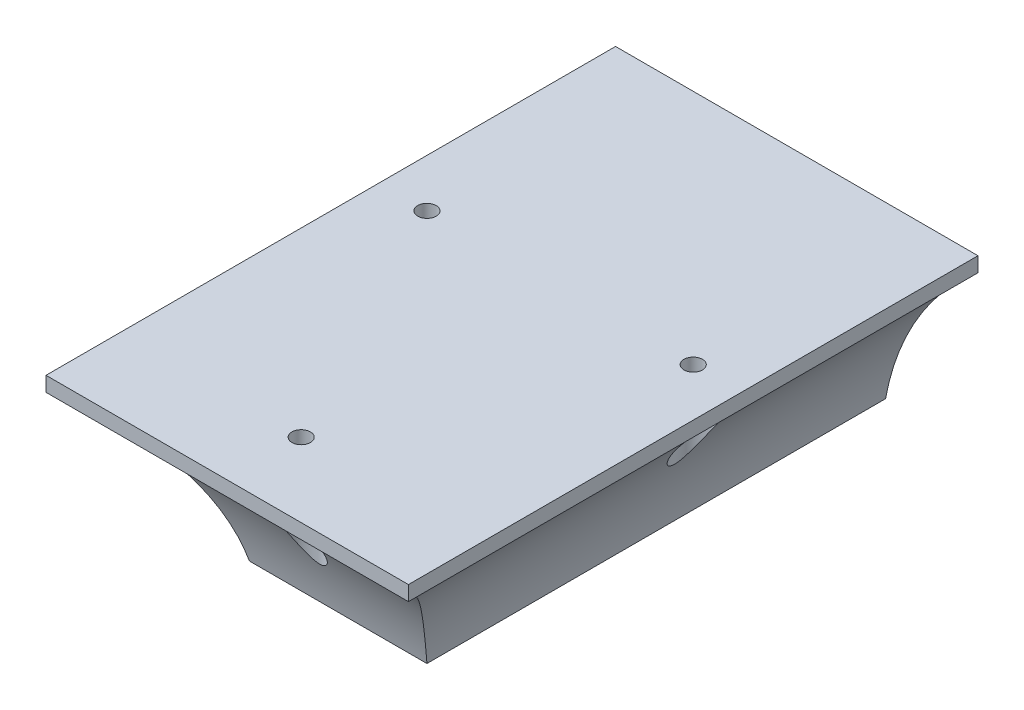
from build123d import *

# Parameters (mm, degrees)
BOSS_EXTRUDE1_DEPTH                  = 38.1
BOSS_EXTRUDE3_DEPTH                  = 76.2
BOSS_EXTRUDE2_REACH                  = 53.498
BOSS_EXTRUDE2_END_RADIUS             = 44.45
BOSS_EXTRUDE2_DIRECTION_2_REACH      = 53.498
BOSS_EXTRUDE2_DIRECTION_2_END_RADIUS = 44.45
CUT_EXTRUDE3_DEPTH                   = 86.067352916
CUT_EXTRUDE1_REACH                   = 71.308
SKETCH4_R                            = 3.175
CUT_EXTRUDE1_DIRECTION_2_DEPTH       = 6.35
CUT_EXTRUDE2_REACH                   = 73.089
SKETCH5_R                            = 1.5875
LPATTERN1_COUNT                      = 2
LPATTERN1_PITCH                      = 44.45
LPATTERN1_COUNT_DIR2                 = 2
LPATTERN1_PITCH_DIR2                 = 22.86
MIRROR1_COPY_1_REACH                 = 71.308
MIRROR1_COPY_1_SKETCH_R              = 3.175
MIRROR1_COPY_2_SKETCH_R              = 3.175
MIRROR1_COPY_2_DEPTH                 = 6.35
MIRROR1_COPY_3_REACH                 = 73.089
MIRROR1_COPY_3_SKETCH_R              = 1.5875


with BuildPart() as part:
    # Sketch1 → Boss-Extrude1 (new, symmetric)
    with BuildSketch(Plane.XY):
        with BuildLine():
            Line((12.7, 12.7), (-12.7, 12.7))
            Line((-12.7, 12.7), (-12.7, 3.175))
            Line((-12.7, 3.175), (-10.414, 3.175))
            Line((-10.414, 3.175), (-10.414, 5.148491853))
            ThreePointArc((-10.414, 5.148491853), (-10.075709883, 5.709908138), (-9.421281116, 5.673146216))
            Line((-9.421281116, 5.673146216), (-4.826, 2.54))
            Line((-4.826, 2.54), (-4.826, -2.54))
            Line((-4.826, -2.54), (-9.421281116, -5.673146216))
            ThreePointArc((-9.421281116, -5.673146216), (-10.075709883, -5.709908138), (-10.414, -5.148491853))
            Line((-10.414, -5.148491853), (-10.414, -3.175))
            Line((-10.414, -3.175), (-12.7, -3.175))
            Line((-12.7, -3.175), (-12.7, -12.7))
            Line((-12.7, -12.7), (-8.89, -12.7))
            Line((-8.89, -12.7), (-8.89, -13.97))
            Line((-8.89, -13.97), (-15.24, -13.97))
            Line((-15.24, -13.97), (-15.24, 15.24))
            Line((-15.24, 15.24), (15.24, 15.24))
            Line((15.24, 15.24), (15.24, -13.97))
            Line((15.24, -13.97), (8.89, -13.97))
            Line((8.89, -13.97), (8.89, -12.7))
            Line((8.89, -12.7), (12.7, -12.7))
            Line((12.7, -12.7), (12.7, -3.175))
            Line((12.7, -3.175), (10.414, -3.175))
            Line((10.414, -3.175), (10.414, -5.148491853))
            ThreePointArc((10.414, -5.148491853), (10.075709883, -5.709908138), (9.421281116, -5.673146216))
            Line((9.421281116, -5.673146216), (4.826, -2.54))
            Line((4.826, -2.54), (4.826, 2.54))
            Line((4.826, 2.54), (9.421281116, 5.673146216))
            ThreePointArc((9.421281116, 5.673146216), (10.075709883, 5.709908138), (10.414, 5.148491853))
            Line((10.414, 5.148491853), (10.414, 3.175))
            Line((10.414, 3.175), (12.7, 3.175))
            Line((12.7, 3.175), (12.7, 12.7))
        make_face()
    extrude(amount=BOSS_EXTRUDE1_DEPTH, both=True)

    # Sketch6 → Boss-Extrude3 (add)
    with BuildSketch(Plane(origin=(0, 0, -38.1), x_dir=(-1, 0, 0), z_dir=(0, 0, -1))):
        with BuildLine():
            Line((-15.24, 15.24), (-31.115, 15.24))
            Line((-31.115, 15.24), (-31.115, 12.7))
            ThreePointArc((-31.115, 12.7), (-20.774098647, 0.795596044), (-15.24, -13.97))
            Line((-15.24, -13.97), (-15.24, 15.24))
        make_face()
        with BuildLine():
            Line((15.24, 15.24), (31.115, 15.24))
            Line((31.115, 15.24), (31.115, 12.7))
            ThreePointArc((31.115, 12.7), (20.774098647, 0.795596044), (15.24, -13.97))
            Line((15.24, -13.97), (15.24, 15.24))
        make_face()
    extrude(amount=-BOSS_EXTRUDE3_DEPTH)

    # Boss-Extrude2: up to this cylinder (the profile starts outside it)
    boss_extrude2_end = Plane(origin=(58.969667359, -21.939861523, 45.16983), z_dir=(0, 0, -1)) * Cylinder(BOSS_EXTRUDE2_END_RADIUS, 196.896, mode=Mode.PRIVATE)
    # Sketch3 → Boss-Extrude2 (add, up to the surface)
    with BuildSketch(Plane(origin=(0, 0, 0), x_dir=(0, 0, -1), z_dir=(1, 0, 0)), mode=Mode.PRIVATE) as boss_extrude2_sk1:
        with BuildLine():
            Line((-59.69, 15.24), (-59.69, 12.7))
            ThreePointArc((-59.69, 12.7), (-47.617150174, 1.184892733), (-40.64, -13.97))
            Line((-40.64, -13.97), (-38.1, -13.97))
            Line((-38.1, -13.97), (-38.1, 15.24))
            Line((-38.1, 15.24), (-59.69, 15.24))
        make_face()
    boss_extrude2_tool1 = extrude(boss_extrude2_sk1.sketch, amount=BOSS_EXTRUDE2_REACH, mode=Mode.PRIVATE) - boss_extrude2_end
    add(boss_extrude2_tool1.solids().sort_by_distance((0, 5.474065, 45.16983))[0])

    # Boss-Extrude2 direction 2: up to this cylinder (the profile starts outside it)
    boss_extrude2_direction_2_end = Plane(origin=(-58.969667359, -21.939861523, 45.16983), z_dir=(0, 0, -1)) * Cylinder(BOSS_EXTRUDE2_DIRECTION_2_END_RADIUS, 196.896, mode=Mode.PRIVATE)
    # Sketch3 → Boss-Extrude2 direction 2 (add, up to the surface)
    with BuildSketch(Plane(origin=(0, 0, 0), x_dir=(0, 0, -1), z_dir=(1, 0, 0)), mode=Mode.PRIVATE) as boss_extrude2_direction_2_sk1:
        with BuildLine():
            Line((-59.69, 15.24), (-59.69, 12.7))
            ThreePointArc((-59.69, 12.7), (-47.617150174, 1.184892733), (-40.64, -13.97))
            Line((-40.64, -13.97), (-38.1, -13.97))
            Line((-38.1, -13.97), (-38.1, 15.24))
            Line((-38.1, 15.24), (-59.69, 15.24))
        make_face()
    boss_extrude2_direction_2_tool1 = extrude(boss_extrude2_direction_2_sk1.sketch, amount=-BOSS_EXTRUDE2_DIRECTION_2_REACH, mode=Mode.PRIVATE) - boss_extrude2_direction_2_end
    add(boss_extrude2_direction_2_tool1.solids().sort_by_distance((0, 5.474065, 45.16983))[0])

    # Sketch7 → Cut-Extrude3 (cut, through all)
    with BuildSketch(Plane(origin=(0, 0, 38.1), x_dir=(-1, 0, 0), z_dir=(0, 0, -1))):
        with BuildLine():
            Line((34.608624747, 15.24), (31.115, 15.24))
            Line((31.115, 15.24), (31.115, 12.7))
            ThreePointArc((31.115, 12.7), (32.830941454, 14.012461185), (34.608624747, 15.24))
        make_face()
        with BuildLine():
            Line((-31.115, 12.7), (-31.115, 15.24))
            Line((-31.115, 15.24), (-34.608624747, 15.24))
            ThreePointArc((-34.608624747, 15.24), (-32.830941454, 14.012461185), (-31.115, 12.7))
        make_face()
    extrude(amount=-CUT_EXTRUDE3_DEPTH, mode=Mode.SUBTRACT)

    # Sketch4 → Cut-Extrude1 (cut, up to next)
    with BuildSketch(Plane(origin=(0, 2.54, 0), x_dir=(1, 0, 0), z_dir=(0, 1, 0)), mode=Mode.PRIVATE) as cut_extrude1_sk1:
        with Locations(Location((0, -46.99, 0), (0, 0, 90))):
            Circle(SKETCH4_R)
    cut_extrude1_tool1 = extrude(cut_extrude1_sk1.sketch, amount=-CUT_EXTRUDE1_REACH, mode=Mode.PRIVATE) & part.part
    cut_extrude1 = cut_extrude1_tool1.solids().sort_by_distance((0, 2.54, 46.99))[0]
    add(cut_extrude1, mode=Mode.SUBTRACT)

    # Sketch4 → Cut-Extrude1 direction 2 (cut)
    with BuildSketch(Plane(origin=(0, 2.54, 0), x_dir=(1, 0, 0), z_dir=(0, 1, 0))):
        with Locations(Location((0, -46.99, 0), (0, 0, 90))):
            Circle(SKETCH4_R)
    cut_extrude1_direction_2 = extrude(amount=CUT_EXTRUDE1_DIRECTION_2_DEPTH, mode=Mode.SUBTRACT)

    # Sketch5 → Cut-Extrude2 (cut, up to next)
    with BuildSketch(Plane.XZ.offset(-8.89), mode=Mode.PRIVATE) as cut_extrude2_sk1:
        with Locations(Location((0, 46.99, 0), (0, 0, 270))):
            Circle(SKETCH5_R)
    cut_extrude2_tool1 = extrude(cut_extrude2_sk1.sketch, amount=-CUT_EXTRUDE2_REACH, mode=Mode.PRIVATE) & part.part
    cut_extrude2 = cut_extrude2_tool1.solids().sort_by_distance((0, 8.89, 46.99))[0]
    add(cut_extrude2, mode=Mode.SUBTRACT)

    # LPattern1: Cut-Extrude1, Cut-Extrude1 direction 2, Cut-Extrude2; each copy of Cut-Extrude1, Cut-Extrude2 runs up to whatever stops it at its own place
    lpattern1_before = part.part  # the part as the pattern finds it: every copy runs up to it
    lpattern1_cut_extrude1_long = extrude(cut_extrude1_sk1.sketch, amount=-CUT_EXTRUDE1_REACH, mode=Mode.PRIVATE)
    lpattern1_cut_extrude1_tool1 = lpattern1_cut_extrude1_long.moved(Location(Vector(0, 0, -1) * (1 * LPATTERN1_PITCH) + Vector(1, 0, 0) * (1 * LPATTERN1_PITCH_DIR2))) & lpattern1_before
    add(lpattern1_cut_extrude1_tool1.solids().sort_by_distance((22.86, 2.54, 2.54))[0], mode=Mode.SUBTRACT)
    add(cut_extrude1_direction_2.moved(Location(Vector(0, 0, -1) * (1 * LPATTERN1_PITCH) + Vector(1, 0, 0) * (1 * LPATTERN1_PITCH_DIR2))), mode=Mode.SUBTRACT)
    lpattern1_cut_extrude2_long = extrude(cut_extrude2_sk1.sketch, amount=-CUT_EXTRUDE2_REACH, mode=Mode.PRIVATE)
    lpattern1_cut_extrude2_tool1 = lpattern1_cut_extrude2_long.moved(Location(Vector(0, 0, -1) * (1 * LPATTERN1_PITCH) + Vector(1, 0, 0) * (1 * LPATTERN1_PITCH_DIR2))) & lpattern1_before
    add(lpattern1_cut_extrude2_tool1.solids().sort_by_distance((22.86, 8.89, 2.54))[0], mode=Mode.SUBTRACT)

    # Mirror1 copy 1 sketch → Mirror1 copy 1 (cut, up to next)
    with BuildSketch(Plane(origin=(-22.86, 2.54, -44.45), x_dir=(-1, 0, 0), z_dir=(0, 1, 0)), mode=Mode.PRIVATE) as mirror1_copy_1_sk1:
        with Locations((0, 46.99)):
            Circle(MIRROR1_COPY_1_SKETCH_R)
    mirror1_copy_1_tool1 = extrude(mirror1_copy_1_sk1.sketch, amount=-MIRROR1_COPY_1_REACH, mode=Mode.PRIVATE) & part.part
    add(mirror1_copy_1_tool1.solids().sort_by_distance((-22.86, 2.54, 2.54))[0], mode=Mode.SUBTRACT)

    # Mirror1 copy 2 sketch → Mirror1 copy 2 (cut)
    with BuildSketch(Plane(origin=(-22.86, 2.54, -44.45), x_dir=(-1, 0, 0), z_dir=(0, 1, 0))):
        with Locations((0, 46.99)):
            Circle(MIRROR1_COPY_2_SKETCH_R)
    extrude(amount=MIRROR1_COPY_2_DEPTH, mode=Mode.SUBTRACT)

    # Mirror1 copy 3 sketch → Mirror1 copy 3 (cut, up to next)
    with BuildSketch(Plane(origin=(-22.86, 8.89, -44.45), x_dir=(-1, 0, 0), z_dir=(0, -1, 0)), mode=Mode.PRIVATE) as mirror1_copy_3_sk1:
        with Locations((0, -46.99)):
            Circle(MIRROR1_COPY_3_SKETCH_R)
    mirror1_copy_3_tool1 = extrude(mirror1_copy_3_sk1.sketch, amount=-MIRROR1_COPY_3_REACH, mode=Mode.PRIVATE) & part.part
    add(mirror1_copy_3_tool1.solids().sort_by_distance((-22.86, 8.89, 2.54))[0], mode=Mode.SUBTRACT)


solid = part.part
